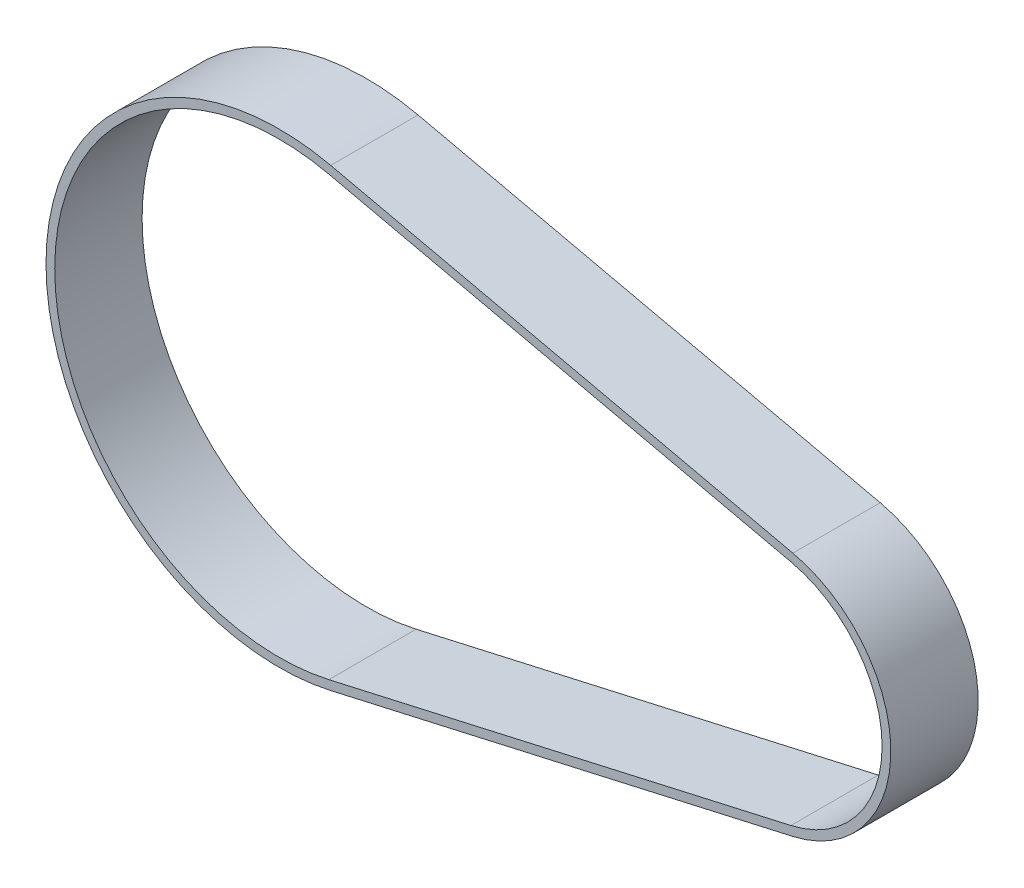
from build123d import *

# Parameters (mm, degrees)
BOSS_EXTRUDE1_DEPTH = 10


with BuildPart() as part:
    # Sketch1 → Boss-Extrude1 (new body)
    with BuildSketch(Plane.XY):
        with BuildLine():
            Line((5.900674976, 26.032644424), (58.799239193, 14.04242057))
            ThreePointArc((58.799239193, 14.04242057), (70.014951459, 0), (58.799239193, -14.04242057))
            Line((58.799239193, -14.04242057), (5.900674976, -26.032644424))
            ThreePointArc((5.900674976, -26.032644424), (-26.693005467, 0), (5.900674976, 26.032644424))
        make_face()
        with BuildLine():
            Line((5.679618004, 25.057383528), (58.578182221, 13.067159674))
            ThreePointArc((58.578182221, 13.067159674), (69.014951459, 0), (58.578182221, -13.067159674))
            Line((58.578182221, -13.067159674), (5.679618004, -25.057383528))
            ThreePointArc((5.679618004, -25.057383528), (-25.693005467, 0), (5.679618004, 25.057383528))
        make_face(mode=Mode.SUBTRACT)
    extrude(amount=BOSS_EXTRUDE1_DEPTH)


solid = part.part
